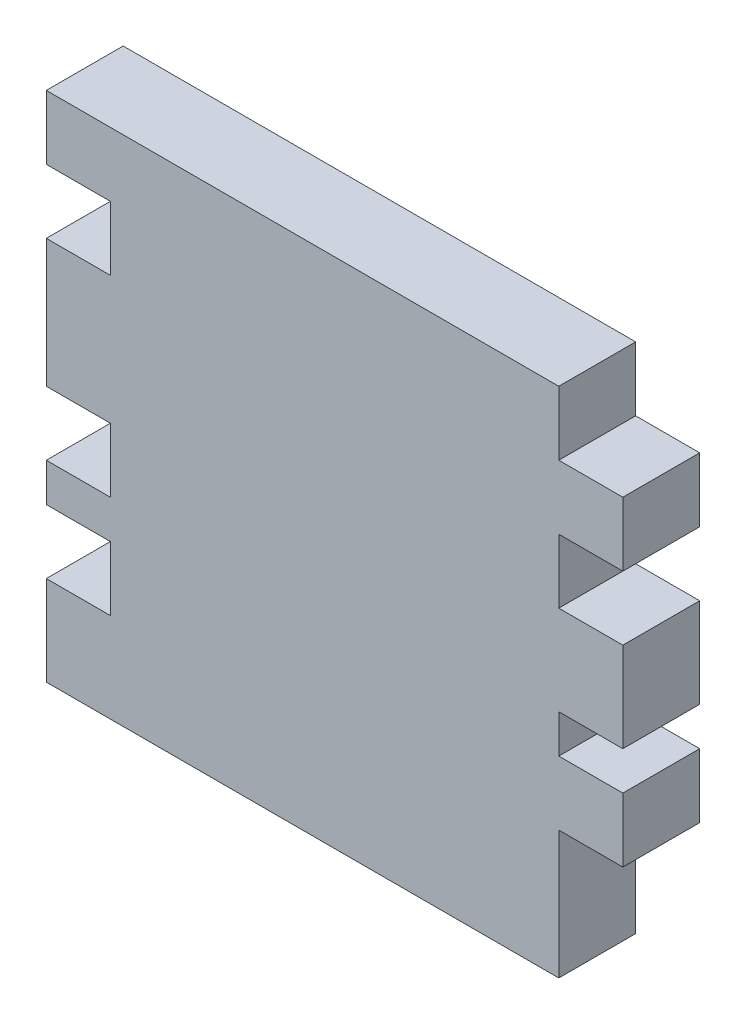
from build123d import *

# Parameters (mm, degrees)
SKETCH1_W           = 45
SKETCH1_H           = 40
BOSS_EXTRUDE1_DEPTH = 6
SKETCH2_W           = 5
SKETCH2_H           = 5
SKETCH2_H_2         = 7
CUT_EXTRUDE1_DEPTH  = 6
SKETCH3_W           = 5
SKETCH3_H           = 5
SKETCH3_H_2         = 3
SKETCH3_H_3         = 10
CUT_EXTRUDE2_DEPTH  = 6
SKETCH4_W           = 5
SKETCH4_H           = 25
BOSS_EXTRUDE3_DEPTH = 6
SKETCH8_W           = 5
SKETCH8_H           = 5
CUT_EXTRUDE5_DEPTH  = 6
SKETCH9_W           = 5
SKETCH9_H           = 40
BOSS_EXTRUDE4_DEPTH = 6
SKETCH10_W          = 5
SKETCH10_H          = 5
SKETCH10_H_2        = 3
SKETCH10_H_3        = 10
CUT_EXTRUDE7_DEPTH  = 6


with BuildPart() as part:
    # Sketch1 → Boss-Extrude1 (new body)
    with BuildSketch(Plane.XY):
        with Locations((1.238898757, -2.615452931)):
            Rectangle(SKETCH1_W, SKETCH1_H)
    extrude(amount=BOSS_EXTRUDE1_DEPTH)

    # Sketch2 → Cut-Extrude1 (cut)
    with BuildSketch(Plane.XY.offset(6)):
        with Locations((-18.761101243, 4.884547069)):
            Rectangle(SKETCH2_W, SKETCH2_H)
        with Locations((-18.761101243, -4.115452931)):
            Rectangle(SKETCH2_W, SKETCH2_H_2)
        with Locations((-18.761101243, -15.115452931)):
            Rectangle(SKETCH2_W, SKETCH2_H)
    extrude(amount=-CUT_EXTRUDE1_DEPTH, mode=Mode.SUBTRACT)

    # Sketch3 → Cut-Extrude2 (cut)
    with BuildSketch(Plane.XY.offset(6)):
        with Locations((21.238898757, -20.115452931)):
            Rectangle(SKETCH3_W, SKETCH3_H)
        with Locations((21.238898757, -9.115452931)):
            Rectangle(SKETCH3_W, SKETCH3_H_2)
        with Locations((21.238898757, 14.884547069)):
            Rectangle(SKETCH3_W, SKETCH3_H)
        with Locations((21.238898757, 2.384547069)):
            Rectangle(SKETCH3_W, SKETCH3_H_3)
    extrude(amount=-CUT_EXTRUDE2_DEPTH, mode=Mode.SUBTRACT)

    # Sketch4 → Boss-Extrude3 (add)
    with BuildSketch(Plane.XY.offset(6)):
        with Locations((-18.761101243, -5.115452931)):
            Rectangle(SKETCH4_W, SKETCH4_H)
    extrude(amount=-BOSS_EXTRUDE3_DEPTH)

    # Sketch8 → Cut-Extrude5 (cut)
    with BuildSketch(Plane.XY.offset(6)):
        with Locations((-18.761101243, -5.115452931)):
            Rectangle(SKETCH8_W, SKETCH8_H)
        with Locations((-18.761101243, -13.115452931)):
            Rectangle(SKETCH8_W, SKETCH8_H)
        with Locations((-18.761101243, 9.884547069)):
            Rectangle(SKETCH8_W, SKETCH8_H)
    extrude(amount=-CUT_EXTRUDE5_DEPTH, mode=Mode.SUBTRACT)

    # Sketch9 → Boss-Extrude4 (add)
    with BuildSketch(Plane.XY.offset(6)):
        with Locations((21.238898757, -2.615452931)):
            Rectangle(SKETCH9_W, SKETCH9_H)
    extrude(amount=-BOSS_EXTRUDE4_DEPTH)

    # Sketch10 → Cut-Extrude7 (cut)
    with BuildSketch(Plane.XY.offset(6)):
        with Locations((21.238898757, 14.884547069)):
            Rectangle(SKETCH10_W, SKETCH10_H)
        with Locations((21.238898757, 4.884547069)):
            Rectangle(SKETCH10_W, SKETCH10_H)
        with Locations((21.238898757, -6.115452931)):
            Rectangle(SKETCH10_W, SKETCH10_H_2)
        with Locations((21.238898757, -17.615452931)):
            Rectangle(SKETCH10_W, SKETCH10_H_3)
    extrude(amount=-CUT_EXTRUDE7_DEPTH, mode=Mode.SUBTRACT)


solid = part.part
